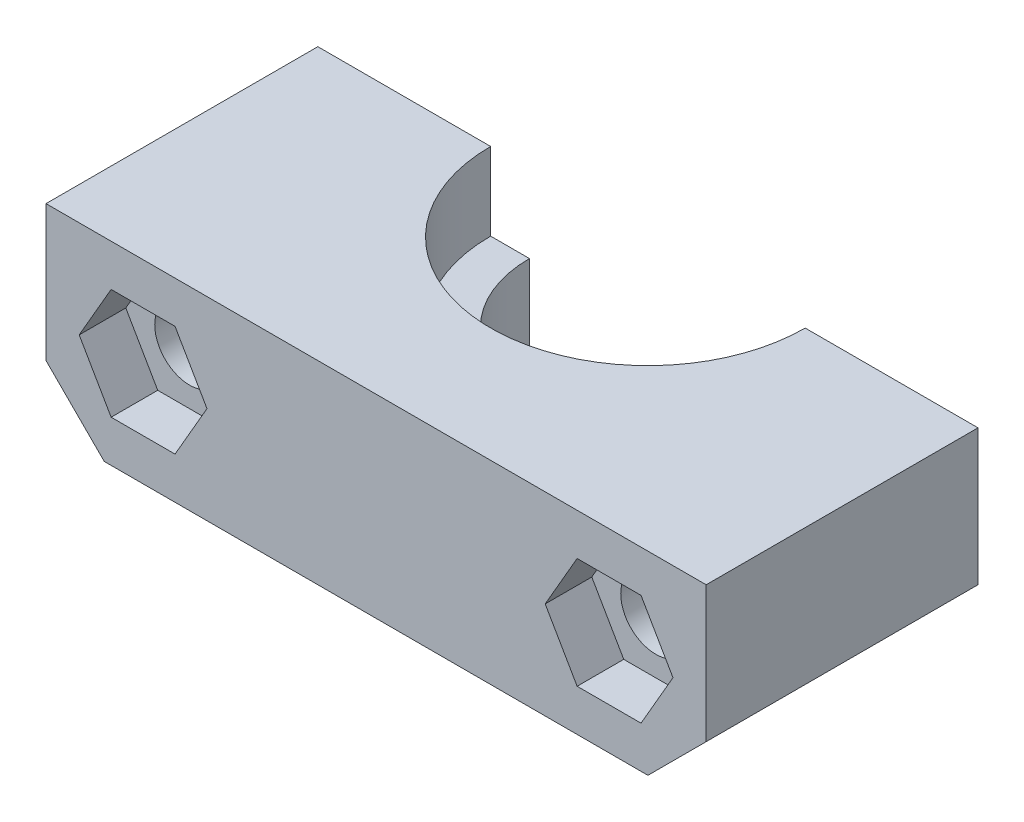
from build123d import *

# Parameters (mm, degrees)
SKETCH1_W               = 34
SKETCH1_H               = 14
BOSS_EXTRUDE1_DEPTH     = 10
SKETCH2_R               = 8.1
CUT_EXTRUDE1_DEPTH      = 4
CUT_EXTRUDE2_DEPTH      = 39.105117767
CUT_EXTRUDE2_DEPTH_BACK = 39.105117767
SKETCH4_R               = 6.1
CUT_EXTRUDE3_DEPTH      = 39.105117767
CUT_EXTRUDE3_DEPTH_BACK = 39.105117767
SKETCH5_R               = 1.8
CUT_EXTRUDE4_DEPTH      = 2.4
CHAMFER1_SIZE           = 3


with BuildPart() as part:
    # Sketch1 → Boss-Extrude1 (new body)
    with BuildSketch(Plane(origin=(0, 0, 0), x_dir=(1, 0, 0), z_dir=(0, 1, 0))):
        with Locations((17, 7)):
            Rectangle(SKETCH1_W, SKETCH1_H)
    extrude(amount=BOSS_EXTRUDE1_DEPTH)

    # Sketch2 → Cut-Extrude1 (cut)
    with BuildSketch(Plane(origin=(0, 10, 0), x_dir=(1, 0, 0), z_dir=(0, 1, 0))):
        with Locations((17, 14)):
            Circle(SKETCH2_R)
    extrude(amount=-CUT_EXTRUDE1_DEPTH, mode=Mode.SUBTRACT)

    # Sketch4 → Cut-Extrude2 (cut, two sides: drawn at the far end of the back side and taken through both)
    with BuildSketch(Plane(origin=(0, 10, 0), x_dir=(1, 0, 0), z_dir=(0, 1, 0)).offset(-CUT_EXTRUDE2_DEPTH_BACK)):
        with Locations((17, 14)):
            Circle(SKETCH4_R)
    extrude(amount=CUT_EXTRUDE2_DEPTH + CUT_EXTRUDE2_DEPTH_BACK, mode=Mode.SUBTRACT)

    # Sketch5 → Cut-Extrude3 (cut, two sides: drawn at the far end of the back side and taken through both)
    with BuildSketch(Plane(origin=(0, 0, -14), x_dir=(-1, 0, 0), z_dir=(0, 0, -1)).offset(-CUT_EXTRUDE3_DEPTH_BACK)):
        with Locations((-29, 5)):
            Circle(SKETCH5_R)
        with Locations((-5, 5)):
            Circle(SKETCH5_R)
    extrude(amount=CUT_EXTRUDE3_DEPTH + CUT_EXTRUDE3_DEPTH_BACK, mode=Mode.SUBTRACT)

    # Sketch6 → Cut-Extrude4 (cut)
    with BuildSketch(Plane.XY):
        Polygon((8.290896534, 5), (6.645448267, 7.85), (3.354551733, 7.85), (1.709103466, 5), (3.354551733, 2.15), (6.645448267, 2.15), align=None)
        Polygon((25.709103466, 5), (27.354551733, 2.15), (30.645448267, 2.15), (32.290896534, 5), (30.645448267, 7.85), (27.354551733, 7.85), align=None)
    extrude(amount=-CUT_EXTRUDE4_DEPTH, mode=Mode.SUBTRACT)

    # Chamfer1
    chamfer1_edges = [part.edges().sort_by_distance(p)[0] for p in [
        (34, 0, -7),
        (0, 0, -7),
    ]]
    chamfer(chamfer1_edges, length=CHAMFER1_SIZE)


solid = part.part
